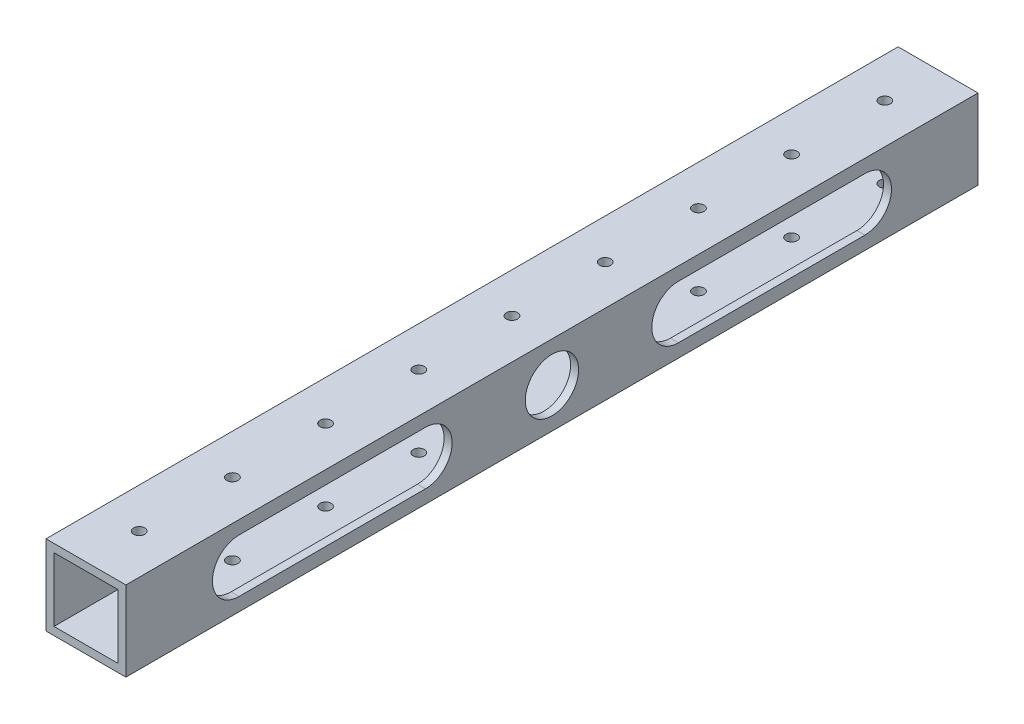
from build123d import *

# Parameters (mm, degrees)
SKETCH_1_W          = 30
SKETCH_1_H          = 30
SKETCH_1_W_2        = 24
SKETCH_1_H_2        = 24
EXTRUDE_1_DEPTH     = 320
SKETCH_2_R          = 10
CUT_EXTRUDE_1_DEPTH = 323.800247831
SKETCH_3_R          = 2.1
CUT_EXTRUDE_2_DEPTH = 323.800247831


with BuildPart() as part:
    # 草图1 → 拉伸-薄壁1 (new body)
    with BuildSketch(Plane.XY):
        with Locations((15, 15)):
            Rectangle(SKETCH_1_W, SKETCH_1_H)
        with Locations((15, 15)):
            Rectangle(SKETCH_1_W_2, SKETCH_1_H_2, mode=Mode.SUBTRACT)
    extrude(amount=EXTRUDE_1_DEPTH)

    # 草图2 → 切除-拉伸1 (cut, through all)
    with BuildSketch(Plane(origin=(30, 0, 0), x_dir=(0, 0, -1), z_dir=(1, 0, 0))):
        with Locations((-160, 15)):
            Circle(SKETCH_2_R)
        with BuildLine():
            Line((-277.5, 25), (-207.5, 25))
            ThreePointArc((-207.5, 25), (-197.5, 15), (-207.5, 5))
            Line((-207.5, 5), (-277.5, 5))
            ThreePointArc((-277.5, 5), (-287.5, 15), (-277.5, 25))
        make_face()
        with BuildLine():
            Line((-42.5, 25), (-112.5, 25))
            ThreePointArc((-112.5, 25), (-122.5, 15), (-112.5, 5))
            Line((-112.5, 5), (-42.5, 5))
            ThreePointArc((-42.5, 5), (-32.5, 15), (-42.5, 25))
        make_face()
    extrude(amount=-CUT_EXTRUDE_1_DEPTH, mode=Mode.SUBTRACT)

    # 草图3 → 切除-拉伸2 (cut, through all)
    with BuildSketch(Plane(origin=(0, 30, 0), x_dir=(1, 0, 0), z_dir=(0, 1, 0))):
        with Locations(Location((15, -20, 0), (0, 0, 270))):
            Circle(SKETCH_3_R)
        with Locations(Location((15, -55, 0), (0, 0, 270))):
            Circle(SKETCH_3_R)
        with Locations(Location((15, -90, 0), (0, 0, 270))):
            Circle(SKETCH_3_R)
        with Locations(Location((15, -125, 0), (0, 0, 270))):
            Circle(SKETCH_3_R)
        with Locations(Location((15, -300, 0), (0, 0, 90))):
            Circle(SKETCH_3_R)
        with Locations(Location((15, -265, 0), (0, 0, 90))):
            Circle(SKETCH_3_R)
        with Locations(Location((15, -230, 0), (0, 0, 90))):
            Circle(SKETCH_3_R)
        with Locations(Location((15, -195, 0), (0, 0, 90))):
            Circle(SKETCH_3_R)
        with Locations(Location((15, -160, 0), (0, 0, 270))):
            Circle(SKETCH_3_R)
    extrude(amount=-CUT_EXTRUDE_2_DEPTH, mode=Mode.SUBTRACT)


solid = part.part
